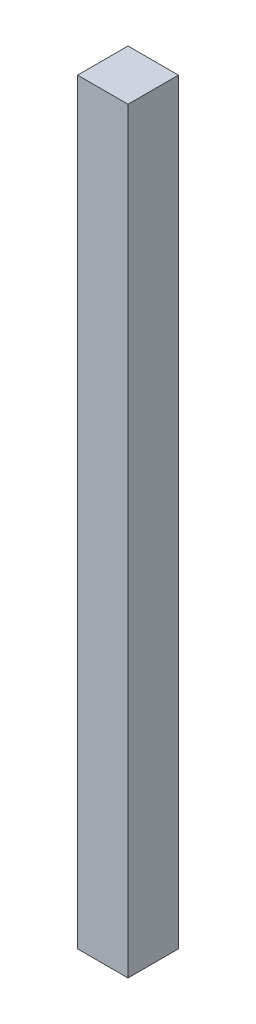
from build123d import *

# Parameters (mm, degrees)
SKETCH1_W           = 1
SKETCH1_H           = 1
BOSS_EXTRUDE1_DEPTH = 15


with BuildPart() as part:
    # Sketch1 → Boss-Extrude1 (new body)
    with BuildSketch(Plane(origin=(0, 0, 0), x_dir=(1, 0, 0), z_dir=(0, 1, 0))):
        Rectangle(SKETCH1_W, SKETCH1_H)
    extrude(amount=BOSS_EXTRUDE1_DEPTH)


solid = part.part
